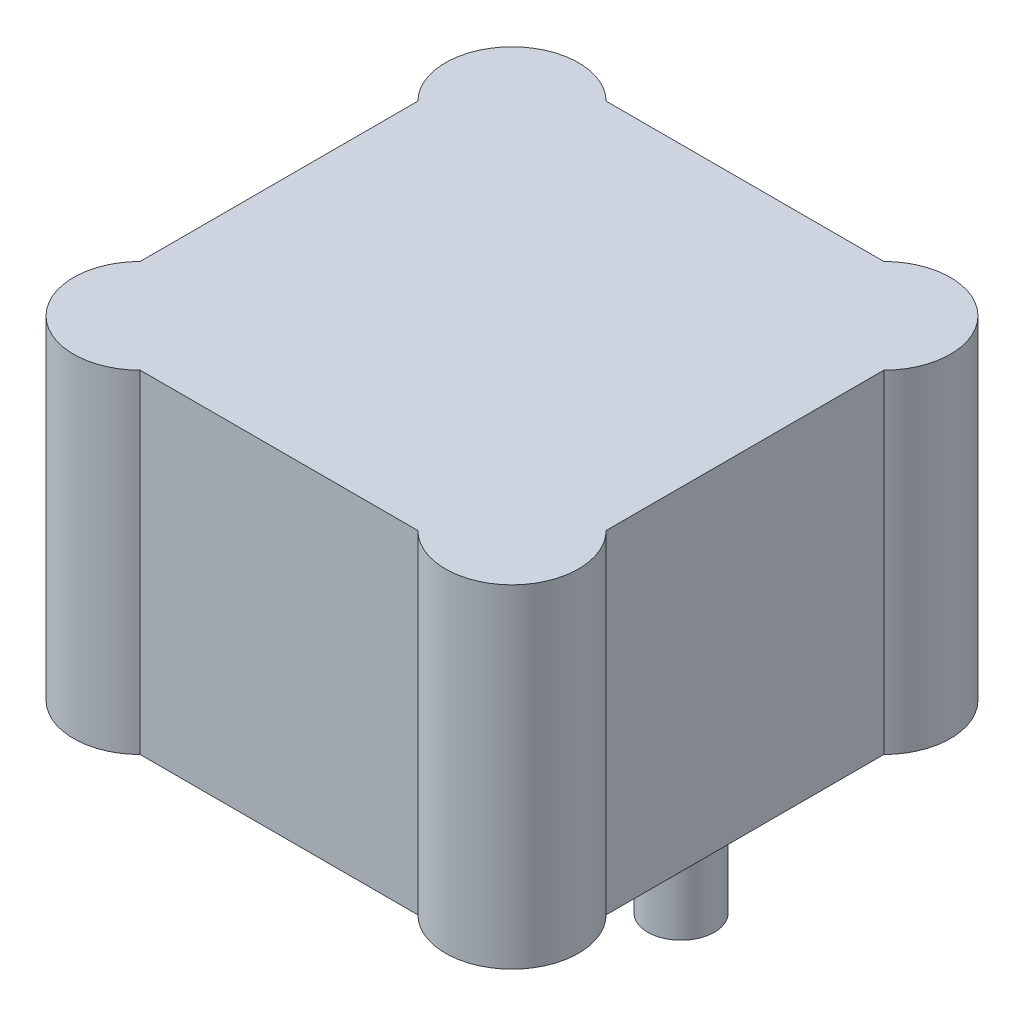
from build123d import *

# Parameters (mm, degrees)
BOSS_EXTRUDE1_DEPTH = 10
SKETCH2_R           = 2
SKETCH2_R_2         = 1
BOSS_EXTRUDE2_DEPTH = 3


with BuildPart() as part:
    # Sketch1 → Boss-Extrude1 (new body)
    with BuildSketch(Plane(origin=(0, 0, 0), x_dir=(1, 0, 0), z_dir=(0, 1, 0))):
        with BuildLine():
            Line((-4.171572875, -7), (4.171572875, -7))
            ThreePointArc((4.171572875, -7), (7, -7), (7, -4.171572875))
            Line((7, -4.171572875), (7, 4.171572875))
            ThreePointArc((7, 4.171572875), (7, 7), (4.171572875, 7))
            Line((4.171572875, 7), (-4.171572875, 7))
            ThreePointArc((-4.171572875, 7), (-7, 7), (-7, 4.171572875))
            Line((-7, 4.171572875), (-7, -4.171572875))
            ThreePointArc((-7, -4.171572875), (-7, -7), (-4.171572875, -7))
        make_face()
    extrude(amount=BOSS_EXTRUDE1_DEPTH)

    # Sketch2 → Boss-Extrude2 (add)
    with BuildSketch(Plane.XZ):
        with Locations(Location((0, 0, 0), (0, 0, 90))):
            Circle(SKETCH2_R)
        with Locations(Location((-5.08, 0, 0), (0, 0, 90))):
            Circle(SKETCH2_R_2)
        with Locations(Location((5.08, 0, 0), (0, 0, 90))):
            Circle(SKETCH2_R_2)
    extrude(amount=BOSS_EXTRUDE2_DEPTH)


solid = part.part
